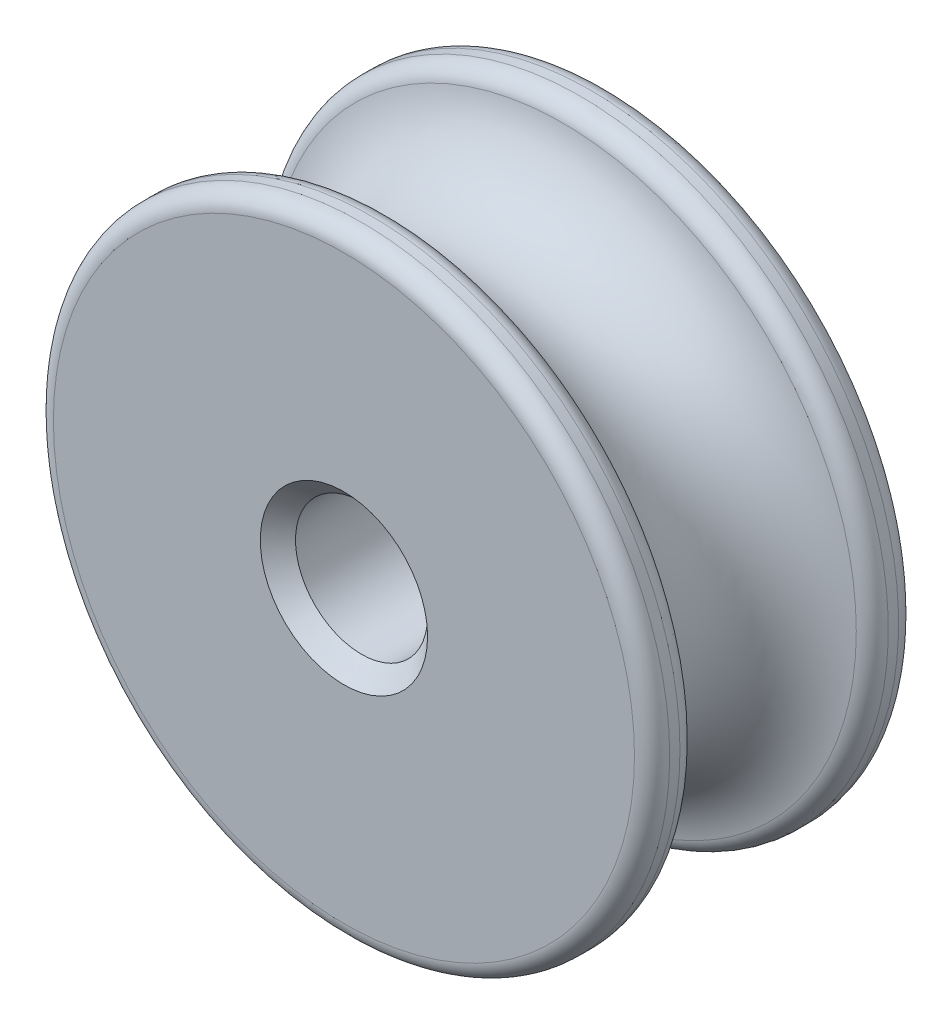
from build123d import *

# Parameters (mm, degrees)
FILLET1_R          = 0.508
SKETCH2_R          = 1.905
CUT_EXTRUDE1_DEPTH = 15.701312987
CHAMFER1_SIZE      = 0.508


with BuildPart() as part:
    # Sketch1 → Revolve1 (revolve)
    with BuildSketch(Plane(origin=(0, 0, 0), x_dir=(1, 0, 0), z_dir=(0, 1, 0))):
        with BuildLine():
            Line((8.89, 6.35), (8.89, 7.62))
            Line((8.89, 7.62), (0, 7.62))
            Line((0, 7.62), (0, 0))
            Line((0, 0), (8.89, 0))
            Line((8.89, 0), (8.89, 1.27))
            ThreePointArc((8.89, 1.27), (6.35, 3.81), (8.89, 6.35))
        make_face()
    revolve(axis=Axis((0, 0, 0), (0, 0, -1)))

    # Fillet1
    fillet1_edges = [part.edges().sort_by_distance(p)[0] for p in [
        (-8.89, 0, 0),
        (-8.89, 0, -1.27),
        (-8.89, 0, -6.35),
        (-8.89, 0, -7.62),
    ]]
    fillet(fillet1_edges, radius=FILLET1_R)

    # Sketch2 → Cut-Extrude1 (cut, through all)
    with BuildSketch(Plane.XY):
        Circle(SKETCH2_R)
    extrude(amount=-CUT_EXTRUDE1_DEPTH, mode=Mode.SUBTRACT)

    # Chamfer1
    chamfer1_edges = [part.edges().sort_by_distance(p)[0] for p in [
        (-1.905, 0, -7.62),
        (-1.905, 0, 0),
    ]]
    chamfer(chamfer1_edges, length=CHAMFER1_SIZE)


solid = part.part
